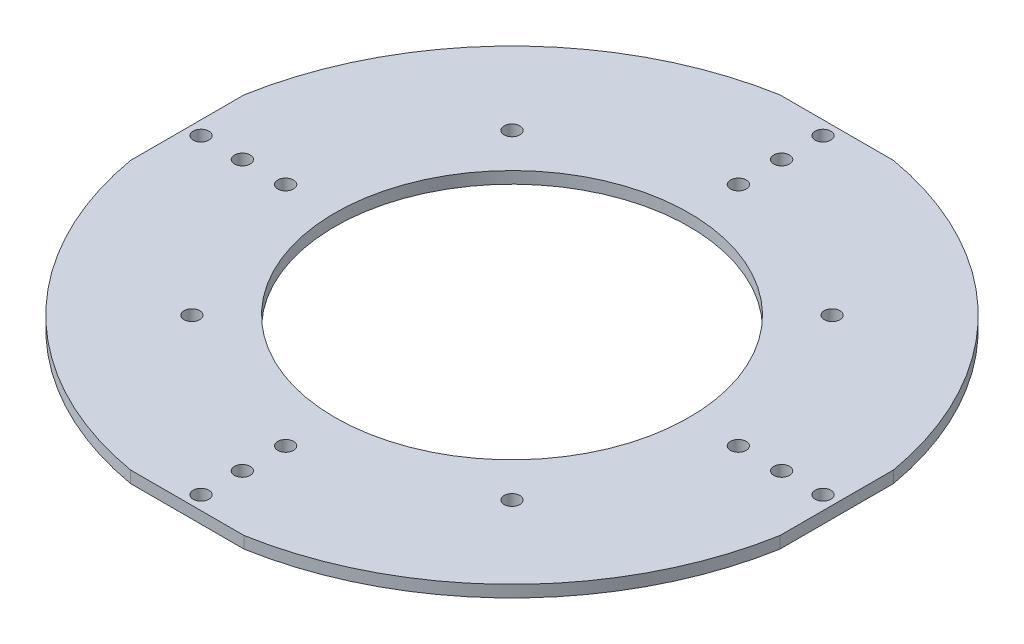
from build123d import *

# Parameters (mm, degrees)
SKETCH1_R           = 167.5
SKETCH1_R_2         = 4
SKETCH1_R_3         = 90
BOSS_EXTRUDE1_DEPTH = 6
SKETCH4_OUTSIDE_W   = 431.76
SKETCH4_OUTSIDE_H   = 431.76
SKETCH4_OUTSIDE_W_2 = 330
SKETCH4_OUTSIDE_H_2 = 330
CUT_EXTRUDE3_DEPTH  = 10


with BuildPart() as part:
    # Sketch1 → Boss-Extrude1 (new body)
    with BuildSketch(Plane(origin=(0, 0, 0), x_dir=(1, 0, 0), z_dir=(0, 1, 0))):
        with Locations(Location((0, 0, 0), (0, 0, 270))):
            Circle(SKETCH1_R)
        with Locations(Location((0, 115, 0), (0, 0, 270))):
            Circle(SKETCH1_R_2, mode=Mode.SUBTRACT)
        with Locations(Location((0, 0, 0), (0, 0, 270))):
            Circle(SKETCH1_R_3, mode=Mode.SUBTRACT)
        with Locations(Location((-137, 0, 0), (0, 0, 270))):
            Circle(SKETCH1_R_2, mode=Mode.SUBTRACT)
        with Locations(Location((-158, 0, 0), (0, 0, 270))):
            Circle(SKETCH1_R_2, mode=Mode.SUBTRACT)
        with Locations(Location((0, -158, 0), (0, 0, 270))):
            Circle(SKETCH1_R_2, mode=Mode.SUBTRACT)
        with Locations(Location((0, -137, 0), (0, 0, 270))):
            Circle(SKETCH1_R_2, mode=Mode.SUBTRACT)
        with Locations(Location((81.317279836, 81.317279836, 0), (0, 0, 270))):
            Circle(SKETCH1_R_2, mode=Mode.SUBTRACT)
        with Locations(Location((115, 0, 0), (0, 0, 270))):
            Circle(SKETCH1_R_2, mode=Mode.SUBTRACT)
        with Locations(Location((81.317279836, -81.317279836, 0), (0, 0, 270))):
            Circle(SKETCH1_R_2, mode=Mode.SUBTRACT)
        with Locations(Location((0, -115, 0), (0, 0, 270))):
            Circle(SKETCH1_R_2, mode=Mode.SUBTRACT)
        with Locations(Location((-81.317279836, -81.317279836, 0), (0, 0, 270))):
            Circle(SKETCH1_R_2, mode=Mode.SUBTRACT)
        with Locations(Location((-115, 0, 0), (0, 0, 270))):
            Circle(SKETCH1_R_2, mode=Mode.SUBTRACT)
        with Locations(Location((-81.317279836, 81.317279836, 0), (0, 0, 270))):
            Circle(SKETCH1_R_2, mode=Mode.SUBTRACT)
        with Locations(Location((0, 137, 0), (0, 0, 270))):
            Circle(SKETCH1_R_2, mode=Mode.SUBTRACT)
        with Locations(Location((0, 158, 0), (0, 0, 270))):
            Circle(SKETCH1_R_2, mode=Mode.SUBTRACT)
        with Locations(Location((137, 0, 0), (0, 0, 270))):
            Circle(SKETCH1_R_2, mode=Mode.SUBTRACT)
        with Locations(Location((158, 0, 0), (0, 0, 270))):
            Circle(SKETCH1_R_2, mode=Mode.SUBTRACT)
    extrude(amount=BOSS_EXTRUDE1_DEPTH)

    # Sketch4 outside → Cut-Extrude3 (cut)
    with BuildSketch(Plane(origin=(0, 6, 0), x_dir=(1, 0, 0), z_dir=(0, 1, 0))):
        Rectangle(SKETCH4_OUTSIDE_W, SKETCH4_OUTSIDE_H)
        Rectangle(SKETCH4_OUTSIDE_W_2, SKETCH4_OUTSIDE_H_2, mode=Mode.SUBTRACT)
    extrude(amount=-CUT_EXTRUDE3_DEPTH, mode=Mode.SUBTRACT)


solid = part.part
